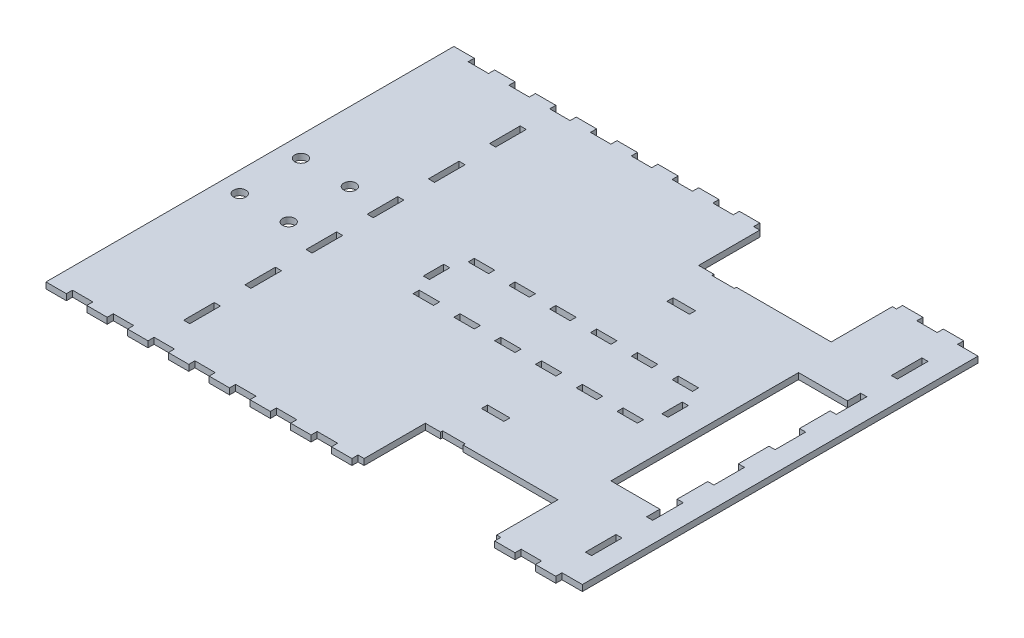
from build123d import *

# Parameters (mm, degrees)
SKETCH3_R           = 3
SKETCH3_W           = 3
SKETCH3_H           = 15
SKETCH3_W_2         = 10
SKETCH3_H_2         = 3
SKETCH3_H_3         = 10
BOSS_EXTRUDE1_DEPTH = 3
SKETCH4_W           = 24
SKETCH4_H           = 92
CUT_EXTRUDE1_DEPTH  = 10
SKETCH5_W           = 11
SKETCH5_H           = 3
CUT_EXTRUDE2_DEPTH  = 10


with BuildPart() as part:
    # Sketch3 → Boss-Extrude1 (new body)
    with BuildSketch(Plane(origin=(0, 0, 0), x_dir=(1, 0, 0), z_dir=(0, 1, 0))):
        Polygon((-300, -97), (-300, 97), (-300, 100), (-290, 100), (-290, 97), (-280, 97), (-280, 100), (-270, 100), (-270, 97), (-260, 97), (-260, 100), (-250, 100), (-250, 97), (-240, 97), (-240, 100), (-230, 100), (-230, 97), (-220, 97), (-220, 100), (-210, 100), (-210, 97), (-200, 97), (-200, 100), (-190, 100), (-190, 97), (-180, 97), (-180, 100), (-170, 100), (-170, 97), (-160, 97), (-160, 100), (-150, 100), (-150, 97), (-140, 97), (-140, 100), (-130, 100), (-130, 97), (-120, 97), (-120, 100), (-110, 100), (-110, 97), (-100, 97), (-100, 100), (-90, 100), (-90, 97), (-80, 97), (-80, 100), (-70, 100), (-70, 97), (-60, 97), (-60, 100), (-50, 100), (-50, 97), (-40, 97), (-40, -97), (-50, -97), (-50, -100), (-60, -100), (-60, -97), (-70, -97), (-70, -100), (-80, -100), (-80, -97), (-90, -97), (-90, -100), (-100, -100), (-100, -97), (-110, -97), (-110, -100), (-120, -100), (-120, -97), (-130, -97), (-130, -100), (-140, -100), (-140, -97), (-150, -97), (-150, -100), (-160, -100), (-160, -97), (-170, -97), (-170, -100), (-180, -100), (-180, -97), (-190, -97), (-190, -100), (-200, -100), (-200, -97), (-210, -97), (-210, -100), (-220, -100), (-220, -97), (-230, -97), (-230, -100), (-240, -100), (-240, -97), (-250, -97), (-250, -100), (-260, -100), (-260, -97), (-270, -97), (-270, -100), (-280, -100), (-280, -97), (-290, -97), (-290, -100), (-300, -100), align=None)
        with Locations(Location((-290, 15, 0), (0, 0, 270))):
            Circle(SKETCH3_R, mode=Mode.SUBTRACT)
        with Locations(Location((-266, 15, 0), (0, 0, 270))):
            Circle(SKETCH3_R, mode=Mode.SUBTRACT)
        with Locations(Location((-266, -15, 0), (0, 0, 270))):
            Circle(SKETCH3_R, mode=Mode.SUBTRACT)
        with Locations(Location((-290, -15, 0), (0, 0, 270))):
            Circle(SKETCH3_R, mode=Mode.SUBTRACT)
        with Locations((-51.5, 45)):
            Rectangle(SKETCH3_W, SKETCH3_H, mode=Mode.SUBTRACT)
        with Locations((-51.5, 15)):
            Rectangle(SKETCH3_W, SKETCH3_H, mode=Mode.SUBTRACT)
        with Locations((-248.5, 45)):
            Rectangle(SKETCH3_W, SKETCH3_H, mode=Mode.SUBTRACT)
        with Locations((-248.5, 15)):
            Rectangle(SKETCH3_W, SKETCH3_H, mode=Mode.SUBTRACT)
        with Locations((-51.5, 75)):
            Rectangle(SKETCH3_W, SKETCH3_H, mode=Mode.SUBTRACT)
        with Locations((-51.5, -75)):
            Rectangle(SKETCH3_W, SKETCH3_H, mode=Mode.SUBTRACT)
        with Locations((-120, 13.5)):
            Rectangle(SKETCH3_W_2, SKETCH3_H_2, mode=Mode.SUBTRACT)
        with Locations((-91.5, 0)):
            Rectangle(SKETCH3_W, SKETCH3_H_3, mode=Mode.SUBTRACT)
        with Locations((-100, 13.5)):
            Rectangle(SKETCH3_W_2, SKETCH3_H_2, mode=Mode.SUBTRACT)
        with Locations((-140, 13.5)):
            Rectangle(SKETCH3_W_2, SKETCH3_H_2, mode=Mode.SUBTRACT)
        with Locations((-160, 13.5)):
            Rectangle(SKETCH3_W_2, SKETCH3_H_2, mode=Mode.SUBTRACT)
        with Locations((-180, 13.5)):
            Rectangle(SKETCH3_W_2, SKETCH3_H_2, mode=Mode.SUBTRACT)
        with Locations((-200, 13.5)):
            Rectangle(SKETCH3_W_2, SKETCH3_H_2, mode=Mode.SUBTRACT)
        with Locations((-208.5, 0)):
            Rectangle(SKETCH3_W, SKETCH3_H_3, mode=Mode.SUBTRACT)
        with Locations((-120, -13.5)):
            Rectangle(SKETCH3_W_2, SKETCH3_H_2, mode=Mode.SUBTRACT)
        with Locations((-140, -13.5)):
            Rectangle(SKETCH3_W_2, SKETCH3_H_2, mode=Mode.SUBTRACT)
        with Locations((-160, -13.5)):
            Rectangle(SKETCH3_W_2, SKETCH3_H_2, mode=Mode.SUBTRACT)
        with Locations((-180, -13.5)):
            Rectangle(SKETCH3_W_2, SKETCH3_H_2, mode=Mode.SUBTRACT)
        with Locations((-200, -13.5)):
            Rectangle(SKETCH3_W_2, SKETCH3_H_2, mode=Mode.SUBTRACT)
        with Locations((-100, -13.5)):
            Rectangle(SKETCH3_W_2, SKETCH3_H_2, mode=Mode.SUBTRACT)
        with Locations((-248.5, 75)):
            Rectangle(SKETCH3_W, SKETCH3_H, mode=Mode.SUBTRACT)
        with Locations((-248.5, -75)):
            Rectangle(SKETCH3_W, SKETCH3_H, mode=Mode.SUBTRACT)
        with Locations((-248.5, -45)):
            Rectangle(SKETCH3_W, SKETCH3_H, mode=Mode.SUBTRACT)
        with Locations((-248.5, -15)):
            Rectangle(SKETCH3_W, SKETCH3_H, mode=Mode.SUBTRACT)
        with Locations((-51.5, -45)):
            Rectangle(SKETCH3_W, SKETCH3_H, mode=Mode.SUBTRACT)
        with Locations((-51.5, -15)):
            Rectangle(SKETCH3_W, SKETCH3_H, mode=Mode.SUBTRACT)
    extrude(amount=BOSS_EXTRUDE1_DEPTH)

    # Sketch4 → Cut-Extrude1 (cut)
    with BuildSketch(Plane(origin=(0, 3, 0), x_dir=(1, 0, 0), z_dir=(0, 1, 0))):
        with Locations((-65, 0)):
            Rectangle(SKETCH4_W, SKETCH4_H)
    extrude(amount=-CUT_EXTRUDE1_DEPTH, mode=Mode.SUBTRACT)

    # Sketch5 → Cut-Extrude2 (cut)
    with BuildSketch(Plane(origin=(0, 3, 0), x_dir=(1, 0, 0), z_dir=(0, 1, 0))):
        Polygon((-82, 67), (-128.5, 67), (-128.5, 66), (-139.5, 66), (-139.5, 67), (-147, 67), (-147, 97), (-82, 97), align=None)
        Polygon((-147, -67), (-147, -97), (-82, -97), (-82, -67), (-128.5, -67), (-128.5, -66), (-139.5, -66), (-139.5, -67), align=None)
        with Locations((-134, -45.5)):
            Rectangle(SKETCH5_W, SKETCH5_H)
        with Locations((-134, 45.5)):
            Rectangle(SKETCH5_W, SKETCH5_H)
    extrude(amount=-CUT_EXTRUDE2_DEPTH, mode=Mode.SUBTRACT)


with BuildPart() as cut_extrude2_kept_piece:
    # of the separate pieces the step leaves, the one the design keeps (cut_extrude2_pieces_kept)
    add(part.part.solids().sort_by_distance((-300, 0, 100))[0])


solid = cut_extrude2_kept_piece.part
